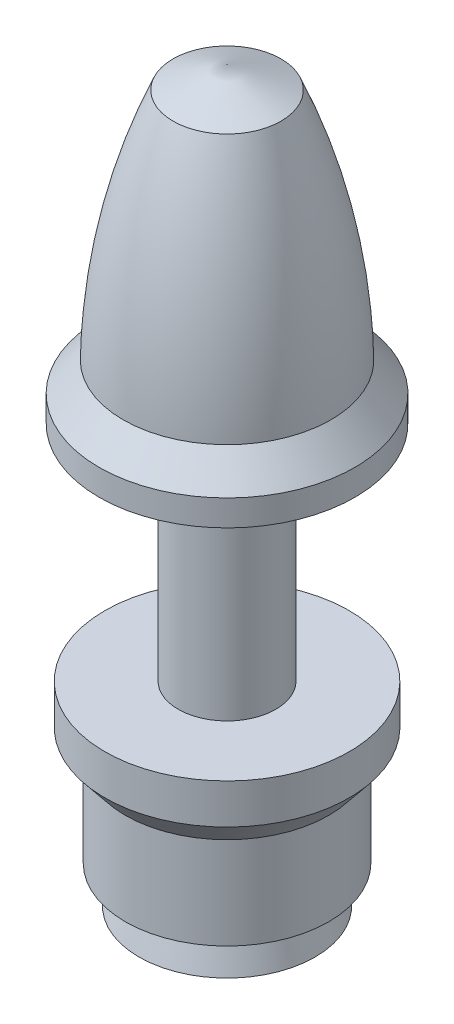
from build123d import *

# Parameters (mm, degrees)
SKETCH2_R          = 1.5748
CUT_EXTRUDE1_DEPTH = 2.54


with BuildPart() as part:
    # Sketch1 → Revolve1 (revolve)
    with BuildSketch(Plane.XY):
        Polygon((0, 0), (4.31165, 0), (3.81, 1.8288), (4.9784, 1.8288), (4.9784, 6.3373), (5.9817, 7.5819), (5.9817, 9.5377), (2.3876, 9.5377), (2.3876, 24.2951), (0, 24.2951), align=None)
    revolve(axis=Axis((0, 24.2951, 0), (0, -1, 0)))

    # Sketch2 → Cut-Extrude1 (cut)
    with BuildSketch(Plane.XZ):
        Circle(SKETCH2_R)
    extrude(amount=-CUT_EXTRUDE1_DEPTH, mode=Mode.SUBTRACT)


with BuildPart() as body_2:
    # Sketch3 → Revolve2 (revolve)
    with BuildSketch(Plane.XY):
        with BuildLine():
            Line((0, 35.6743), (2.6416, 34.5948))
            ThreePointArc((2.6416, 34.5948), (4.407164368, 28.989878367), (5.08, 23.1521))
            Line((5.08, 23.1521), (6.2611, 21.7297))
            Line((6.2611, 21.7297), (6.2611, 20.4597))
            Line((6.2611, 20.4597), (0, 20.4597))
            Line((0, 20.4597), (0, 35.6743))
        make_face()
    revolve(axis=Axis((0, 35.6743, 0), (0, -1, 0)))


solid = Compound([part.part, body_2.part])
